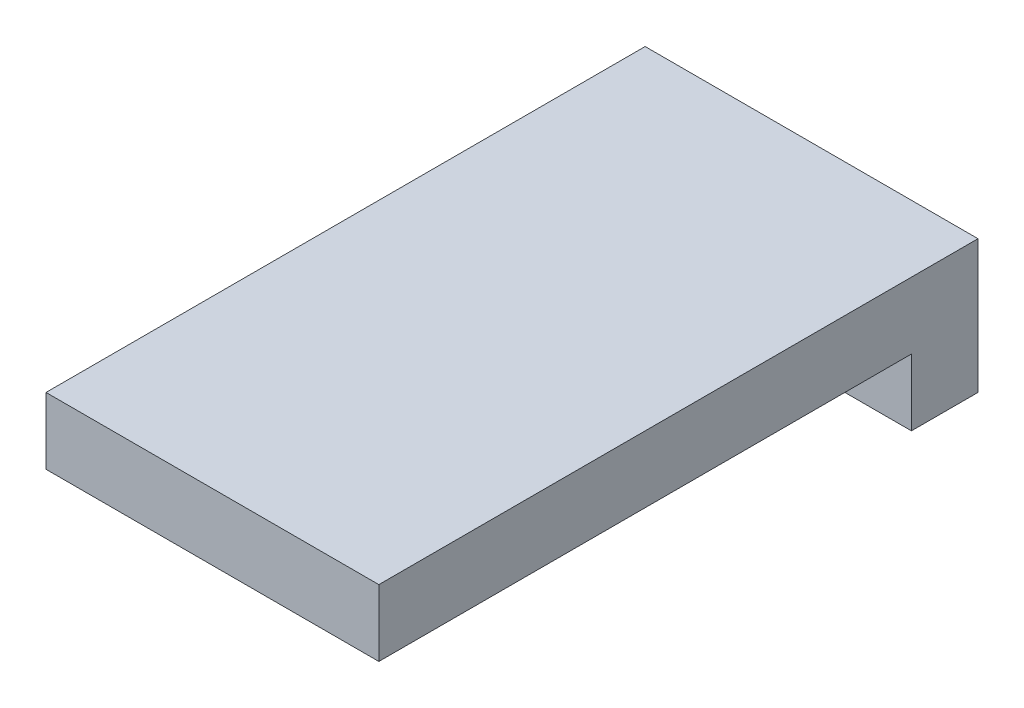
from build123d import *

# Parameters (mm, degrees)
SKETCH1_W           = 25
SKETCH1_H           = 5
BOSS_EXTRUDE1_DEPTH = 10
SKETCH2_W           = 25
SKETCH2_H           = 5
BOSS_EXTRUDE2_DEPTH = 40
SKETCH3_W           = 7
SKETCH3_H           = 2.5
BOSS_EXTRUDE3_DEPTH = 2.5


with BuildPart() as part:
    # Sketch1 → Boss-Extrude1 (new body)
    with BuildSketch(Plane(origin=(0, 0, 0), x_dir=(1, 0, 0), z_dir=(0, 1, 0))):
        Rectangle(SKETCH1_W, SKETCH1_H)
    extrude(amount=BOSS_EXTRUDE1_DEPTH)

    # Sketch2 → Boss-Extrude2 (add)
    with BuildSketch(Plane.XY.offset(2.5)):
        with Locations((0, 7.5)):
            Rectangle(SKETCH2_W, SKETCH2_H)
    extrude(amount=BOSS_EXTRUDE2_DEPTH)

    # Sketch3 → Boss-Extrude3 (add)
    with BuildSketch(Plane.XZ.offset(-5)):
        with Locations((-0.17068016, 37.447744065)):
            Rectangle(SKETCH3_W, SKETCH3_H)
    extrude(amount=BOSS_EXTRUDE3_DEPTH)


solid = part.part
